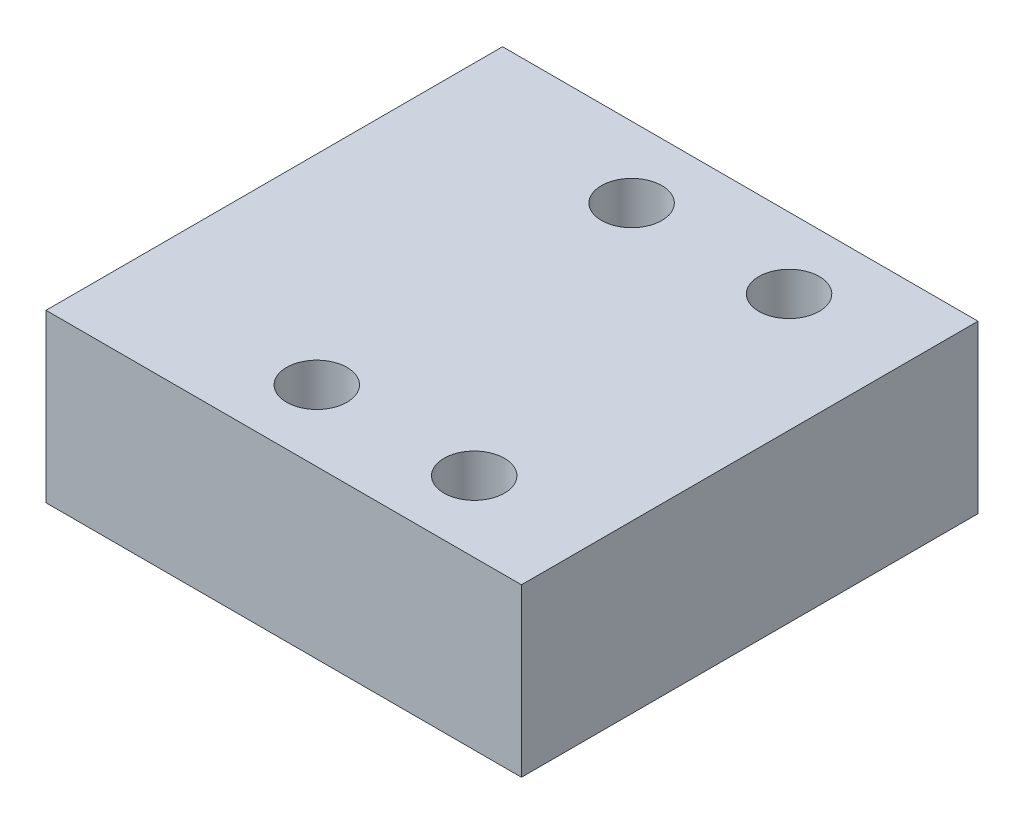
from build123d import *

# Parameters (mm, degrees)
SKETCH1_W           = 38.354
SKETCH1_H           = 36.83
SKETCH1_R           = 2.4384
BOSS_EXTRUDE1_DEPTH = 13.4493


with BuildPart() as part:
    # Sketch1 → Boss-Extrude1 (new body)
    with BuildSketch(Plane(origin=(0, 0, 0), x_dir=(1, 0, 0), z_dir=(0, 1, 0))):
        with Locations((1.470981215, -2.606054656)):
            Rectangle(SKETCH1_W, SKETCH1_H)
        with Locations(Location((-1.577018785, 10.093945344, 0), (0, 0, 270))):
            Circle(SKETCH1_R, mode=Mode.SUBTRACT)
        with Locations(Location((11.122981215, 10.093945344, 0), (0, 0, 90))):
            Circle(SKETCH1_R, mode=Mode.SUBTRACT)
        with Locations(Location((11.122981215, -15.306054656, 0), (0, 0, 270))):
            Circle(SKETCH1_R, mode=Mode.SUBTRACT)
        with Locations(Location((-1.577018785, -15.306054656, 0), (0, 0, 90))):
            Circle(SKETCH1_R, mode=Mode.SUBTRACT)
    extrude(amount=BOSS_EXTRUDE1_DEPTH)


solid = part.part
